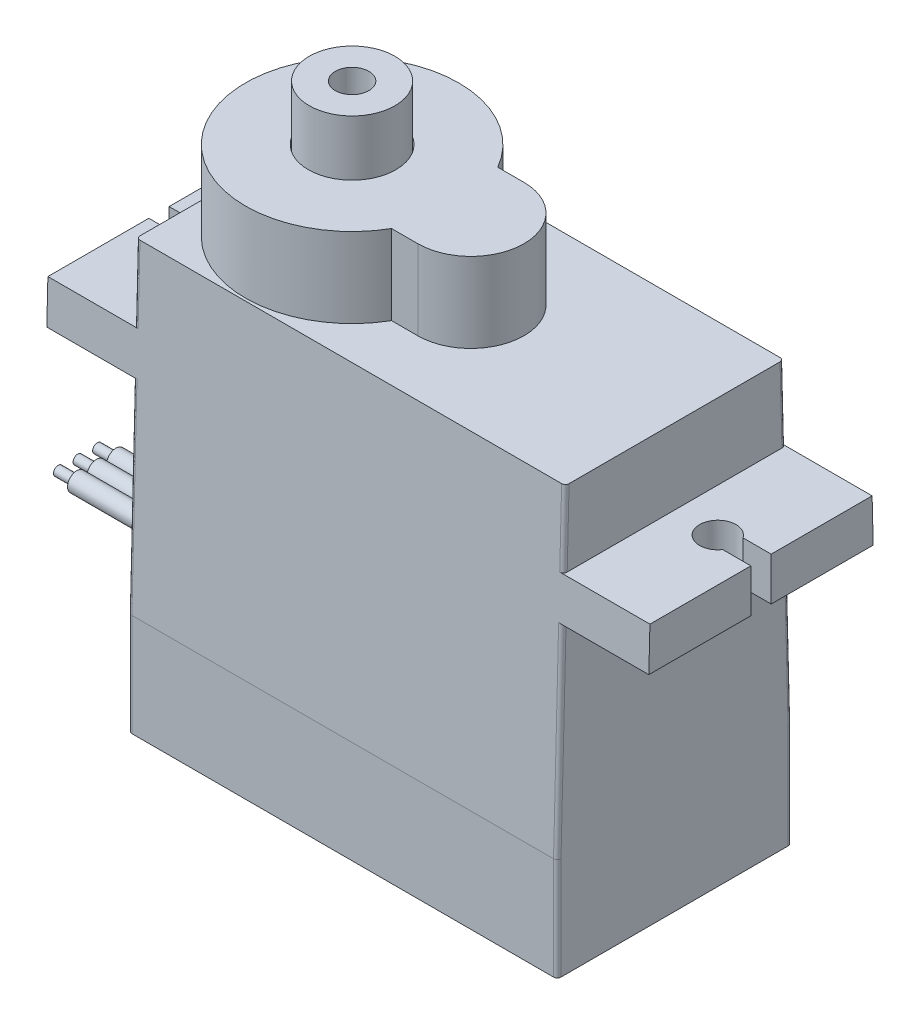
from build123d import *

# Parameters (mm, degrees)
BOSS_EXTRUDE1_DEPTH      = 6.295
BOSS_EXTRUDE2_DEPTH      = 4.28
CUT_EXTRUDE4_DEPTH       = 37.749948639
SKETCH4_R                = 0.975
SKETCH4_W                = 1.511544683
SKETCH4_H                = 1.09
CUT_EXTRUDE1_DEPTH       = 27.991002668
SKETCH5_R                = 1
SKETCH5_R_2              = 0.975
CUT_EXTRUDE2_DEPTH       = 1
SKETCH6_R                = 0.5
BOSS_EXTRUDE4_DEPTH      = 8
SKETCH7_R                = 0.25
BOSS_EXTRUDE5_DEPTH      = 1
FILLET1_R                = 0.3
FILLET3_R                = 0.2
BOSS_EXTRUDE6_DEPTH      = 2.95
BOSS_EXTRUDE6_DEPTH_BACK = 1
SKETCH12_R               = 2.3
SKETCH12_R_2             = 0.9
SKETCH13_R               = 2.35
CUT_EXTRUDE5_DEPTH       = 5


with BuildPart() as part:
    # Sketch1 → Boss-Extrude1 (new, symmetric)
    with BuildSketch(Plane.XY):
        Polygon((-7.13, 6.38), (15.9, 6.38), (15.9, 2.32), (20.54, 2.32), (20.54, 0), (15.9, 0), (15.9, -16.34), (-7.13, -16.34), (-7.13, 0), (-11.77, 0), (-11.77, 2.32), (-7.13, 2.32), align=None)
    extrude(amount=BOSS_EXTRUDE1_DEPTH, both=True)

    # Sketch2 → Boss-Extrude2 (add)
    with BuildSketch(Plane(origin=(0, 6.38, 0), x_dir=(1, 0, 0), z_dir=(0, 1, 0))):
        with BuildLine():
            Line((3.560191336, -2.85), (4.97, -2.85))
            ThreePointArc((4.97, -2.85), (7.82, 0), (4.97, 2.85))
            Line((4.97, 2.85), (3.560191336, 2.85))
            ThreePointArc((3.560191336, 2.85), (-7.13, 0), (3.560191336, -2.85))
        make_face()
    extrude(amount=BOSS_EXTRUDE2_DEPTH)

    # Sketch11 → Cut-Extrude4 (cut, through all)
    with BuildSketch(Plane.ZY.offset(11.77)):
        Polygon((-5.86, 6.38), (-6.295, -10.84), (-6.295, 6.38), align=None)
    cut_extrude4 = extrude(amount=-CUT_EXTRUDE4_DEPTH, mode=Mode.SUBTRACT)

    # Mirror1: Cut-Extrude4 across plane
    add(cut_extrude4.mirror(Plane.XY), mode=Mode.SUBTRACT)

    # Sketch4 → Cut-Extrude1 (cut, through all)
    with BuildSketch(Plane(origin=(0, 0, 0), x_dir=(1, 0, 0), z_dir=(0, 1, 0))):
        with Locations((-9.45, 0)):
            Circle(SKETCH4_R)
        with Locations((-11.014227659, 0)):
            Rectangle(SKETCH4_W, SKETCH4_H)
    cut_extrude1 = extrude(amount=CUT_EXTRUDE1_DEPTH, mode=Mode.SUBTRACT)

    # Mirror2: Cut-Extrude1 across plane
    add(cut_extrude1.mirror(Plane(origin=(4.385, -10.84, 6.295), x_dir=(0, 0, 1), z_dir=(-1, 0, 0))), mode=Mode.SUBTRACT)

    # Sketch5 → Cut-Extrude2 (cut)
    # profile 1 of 4: a face of its own
    with BuildSketch(Plane.XZ.offset(16.34)):
        with Locations((-5.49, 4.35)):
            Circle(SKETCH5_R)
        with Locations((-5.49, 4.35)):
            Circle(SKETCH5_R_2, mode=Mode.SUBTRACT)
    # profile 2 of 4: a face of its own
    with BuildSketch(Plane.XZ.offset(16.34)):
        with Locations((-5.49, -4.35)):
            Circle(SKETCH5_R)
        with Locations((-5.49, -4.35)):
            Circle(SKETCH5_R_2, mode=Mode.SUBTRACT)
    # profile 3 of 4: a face of its own
    with BuildSketch(Plane.XZ.offset(16.34)):
        with Locations((14.26, -4.35)):
            Circle(SKETCH5_R)
        with Locations((14.26, -4.35)):
            Circle(SKETCH5_R_2, mode=Mode.SUBTRACT)
    # profile 4 of 4: a face of its own
    with BuildSketch(Plane.XZ.offset(16.34)):
        with Locations((14.26, 4.35)):
            Circle(SKETCH5_R)
        with Locations((14.26, 4.35)):
            Circle(SKETCH5_R_2, mode=Mode.SUBTRACT)
    extrude(amount=-CUT_EXTRUDE2_DEPTH, mode=Mode.SUBTRACT)

    # Sketch6 → Boss-Extrude4 (add)
    with BuildSketch(Plane.ZY.offset(7.13)):
        with Locations((0, -11.34)):
            Circle(SKETCH6_R)
        with Locations((1.05, -11.34)):
            Circle(SKETCH6_R)
        with Locations((-1.05, -11.34)):
            Circle(SKETCH6_R)
    extrude(amount=BOSS_EXTRUDE4_DEPTH)

    # Sketch7 → Boss-Extrude5 (add)
    with BuildSketch(Plane.ZY.offset(15.13)):
        with Locations((0, -11.34)):
            Circle(SKETCH7_R)
        with Locations((1.05, -11.34)):
            Circle(SKETCH7_R)
        with Locations((-1.05, -11.34)):
            Circle(SKETCH7_R)
    extrude(amount=BOSS_EXTRUDE5_DEPTH)

    # Fillet1
    fillet1_edges = [part.edges().sort_by_distance(p)[0] for p in [
        (13.285, -16.34, -4.35),
        (13.285, -16.34, 4.35),
        (-6.465, -16.34, -4.35),
        (-6.465, -16.34, 4.35),
    ]]
    fillet(fillet1_edges, radius=FILLET1_R)

    # Fillet3
    fillet3_edges = [part.edges().sort_by_distance(p)[0] for p in [
        (15.9, -13.59, -6.295),
        (15.9, -13.59, 6.295),
        (-7.13, -13.59, -6.295),
        (-7.13, -13.59, 6.295),
        (-7.13, -5.42, 6.158083624),
        (-7.13, -5.42, -6.158083624),
        (15.9, -5.42, 6.158083624),
        (15.9, -5.42, -6.158083624),
        (15.9, 4.35, -5.911280488),
        (15.9, 4.35, 5.911280488),
        (-7.13, 4.35, -5.911280488),
        (-7.13, 4.35, 5.911280488),
    ]]
    fillet(fillet3_edges, radius=FILLET3_R)

    # Sketch13 → Cut-Extrude5 (cut)
    with BuildSketch(Plane(origin=(0, 13.61, 0), x_dir=(1, 0, 0), z_dir=(0, 1, 0))):
        with Locations((-1.405, 0)):
            Circle(SKETCH13_R)
    extrude(amount=-CUT_EXTRUDE5_DEPTH, mode=Mode.SUBTRACT)


with BuildPart() as body_2:
    # Sketch12 → Boss-Extrude6 (new, two sides: drawn at the far end of the back side and taken through both)
    with BuildSketch(Plane(origin=(0, 10.66, 0), x_dir=(1, 0, 0), z_dir=(0, 1, 0)).offset(-BOSS_EXTRUDE6_DEPTH_BACK)):
        with Locations((-1.405, 0)):
            Circle(SKETCH12_R)
        with Locations((-1.405, 0)):
            Circle(SKETCH12_R_2, mode=Mode.SUBTRACT)
    extrude(amount=BOSS_EXTRUDE6_DEPTH + BOSS_EXTRUDE6_DEPTH_BACK)


solid = Compound([part.part, body_2.part])
